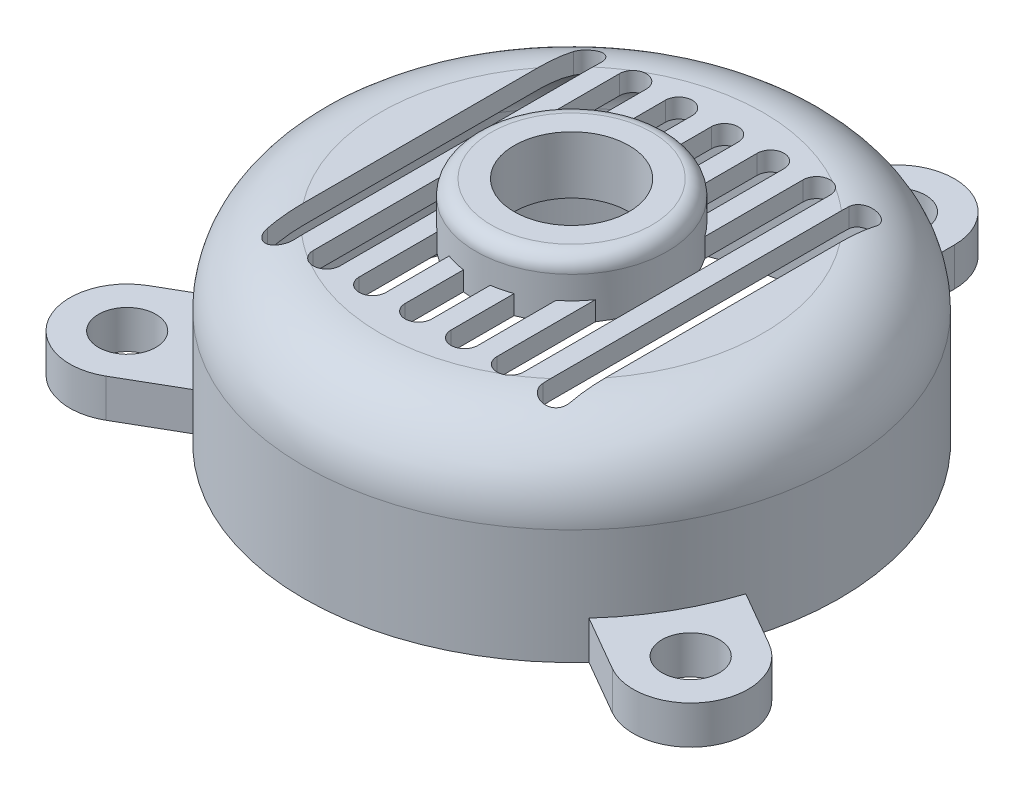
from build123d import *

# Parameters (mm, degrees)
BOSS_EXTRUDE1_DEPTH = 25
FILLET1_R           = 10
SHELL1_T            = -2.5
SKETCH1_3_R         = 3.75
BOSS_EXTRUDE2_DEPTH = 5
CUT_EXTRUDE1_DEPTH  = 35
SKETCH4_R           = 12.5
BOSS_EXTRUDE3_DEPTH = 7.5
SKETCH4_3_R         = 7.5
CUT_EXTRUDE2_DEPTH  = 18.75
FILLET2_R           = 2


with BuildPart() as part:
    # Sketch1 → Boss-Extrude1 (new body)
    with BuildSketch(Plane(origin=(0, 0, 0), x_dir=(1, 0, 0), z_dir=(0, 1, 0))):
        with BuildLine():
            ThreePointArc((33.356798206, -10.598302386), (30.310889132, 17.5), (7.5, 34.186985828))
            ThreePointArc((7.5, 34.186985828), (0, 35), (-7.5, 34.186985828))
            ThreePointArc((-7.5, 34.186985828), (-30.310889132, 17.5), (-33.356798206, -10.598302386))
            ThreePointArc((-33.356798206, -10.598302386), (-30.310889132, -17.5), (-25.856798206, -23.588683442))
            ThreePointArc((-25.856798206, -23.588683442), (0, -35), (25.856798206, -23.588683442))
            ThreePointArc((25.856798206, -23.588683442), (30.310889132, -17.5), (33.356798206, -10.598302386))
        make_face()
    extrude(amount=BOSS_EXTRUDE1_DEPTH)

    # Fillet1
    fillet1_edges = [part.edges().sort_by_distance(p)[0] for p in [
        (33.356798206, 25, -10.598302386),
    ]]
    fillet(fillet1_edges, radius=FILLET1_R)

    # Shell1
    shell1_openings = [part.faces().sort_by_distance(p)[0] for p in [
        (0, 0, 0),
    ]]
    offset(amount=SHELL1_T, openings=shell1_openings, kind=Kind.INTERSECTION)

    # Sketch1<3> → Boss-Extrude2 (add)
    # profile 1 of 3: a face of its own
    with BuildSketch(Plane(origin=(0, 0, 0), x_dir=(1, 0, 0), z_dir=(0, 1, 0))):
        with BuildLine():
            Line((7.5, 34.186985828), (7.5, 42.5))
            ThreePointArc((7.5, 42.5), (0, 50), (-7.5, 42.5))
            Line((-7.5, 42.5), (-7.5, 34.186985828))
            ThreePointArc((-7.5, 34.186985828), (0, 35), (7.5, 34.186985828))
        make_face()
        with Locations((0, 42.5)):
            Circle(SKETCH1_3_R, mode=Mode.SUBTRACT)
    # profile 2 of 3: a face of its own
    with BuildSketch(Plane(origin=(0, 0, 0), x_dir=(1, 0, 0), z_dir=(0, 1, 0))):
        with BuildLine():
            Line((40.556079661, -14.754809472), (33.356798206, -10.598302386))
            ThreePointArc((33.356798206, -10.598302386), (30.310889132, -17.5), (25.856798206, -23.588683442))
            Line((25.856798206, -23.588683442), (33.056079661, -27.745190528))
            ThreePointArc((33.056079661, -27.745190528), (43.301270189, -25), (40.556079661, -14.754809472))
        make_face()
        with Locations((36.806079661, -21.25)):
            Circle(SKETCH1_3_R, mode=Mode.SUBTRACT)
    # profile 3 of 3: a face of its own
    with BuildSketch(Plane(origin=(0, 0, 0), x_dir=(1, 0, 0), z_dir=(0, 1, 0))):
        with BuildLine():
            ThreePointArc((-25.856798206, -23.588683442), (-30.310889132, -17.5), (-33.356798206, -10.598302386))
            Line((-33.356798206, -10.598302386), (-40.556079661, -14.754809472))
            ThreePointArc((-40.556079661, -14.754809472), (-43.301270189, -25), (-33.056079661, -27.745190528))
            Line((-33.056079661, -27.745190528), (-25.856798206, -23.588683442))
        make_face()
        with Locations((-36.806079661, -21.25)):
            Circle(SKETCH1_3_R, mode=Mode.SUBTRACT)
    extrude(amount=BOSS_EXTRUDE2_DEPTH)

    # Sketch2 → Cut-Extrude1 (cut)
    with BuildSketch(Plane.XZ):
        with BuildLine():
            Line((-10.25, 20), (-10.25, -20))
            ThreePointArc((-10.25, -20), (-12, -21.75), (-13.75, -20))
            Line((-13.75, -20), (-13.75, 20))
            ThreePointArc((-13.75, 20), (-12, 21.75), (-10.25, 20))
        make_face()
        with BuildLine():
            Line((-19.75, 20), (-19.75, -20))
            ThreePointArc((-19.75, -20), (-18, -21.75), (-16.25, -20))
            Line((-16.25, -20), (-16.25, 20))
            ThreePointArc((-16.25, 20), (-18, 21.75), (-19.75, 20))
        make_face()
        with BuildLine():
            Line((-4.25, 20), (-4.25, -20))
            ThreePointArc((-4.25, -20), (-6, -21.75), (-7.75, -20))
            Line((-7.75, -20), (-7.75, 20))
            ThreePointArc((-7.75, 20), (-6, 21.75), (-4.25, 20))
        make_face()
        with BuildLine():
            Line((1.75, 20), (1.75, -20))
            ThreePointArc((1.75, -20), (0, -21.75), (-1.75, -20))
            Line((-1.75, -20), (-1.75, 20))
            ThreePointArc((-1.75, 20), (0, 21.75), (1.75, 20))
        make_face()
        with BuildLine():
            Line((7.75, 20), (7.75, -20))
            ThreePointArc((7.75, -20), (6, -21.75), (4.25, -20))
            Line((4.25, -20), (4.25, 20))
            ThreePointArc((4.25, 20), (6, 21.75), (7.75, 20))
        make_face()
        with BuildLine():
            Line((13.75, 20), (13.75, -20))
            ThreePointArc((13.75, -20), (12, -21.75), (10.25, -20))
            Line((10.25, -20), (10.25, 20))
            ThreePointArc((10.25, 20), (12, 21.75), (13.75, 20))
        make_face()
        with BuildLine():
            Line((19.75, 20), (19.75, -20))
            ThreePointArc((19.75, -20), (18, -21.75), (16.25, -20))
            Line((16.25, -20), (16.25, 20))
            ThreePointArc((16.25, 20), (18, 21.75), (19.75, 20))
        make_face()
    extrude(amount=-CUT_EXTRUDE1_DEPTH, mode=Mode.SUBTRACT)

    # Sketch4 → Boss-Extrude3 (add)
    with BuildSketch(Plane.XZ.offset(-22.5)):
        Circle(SKETCH4_R)
    extrude(amount=-BOSS_EXTRUDE3_DEPTH)

    # Sketch4<3> → Cut-Extrude2 (cut, symmetric)
    with BuildSketch(Plane.XZ.offset(-22.5)):
        Circle(SKETCH4_3_R)
    extrude(amount=CUT_EXTRUDE2_DEPTH, both=True, mode=Mode.SUBTRACT)

    # Fillet2
    fillet2_edges = [part.edges().sort_by_distance(p)[0] for p in [
        (-12.5, 30, 0),
    ]]
    fillet(fillet2_edges, radius=FILLET2_R)


solid = part.part
